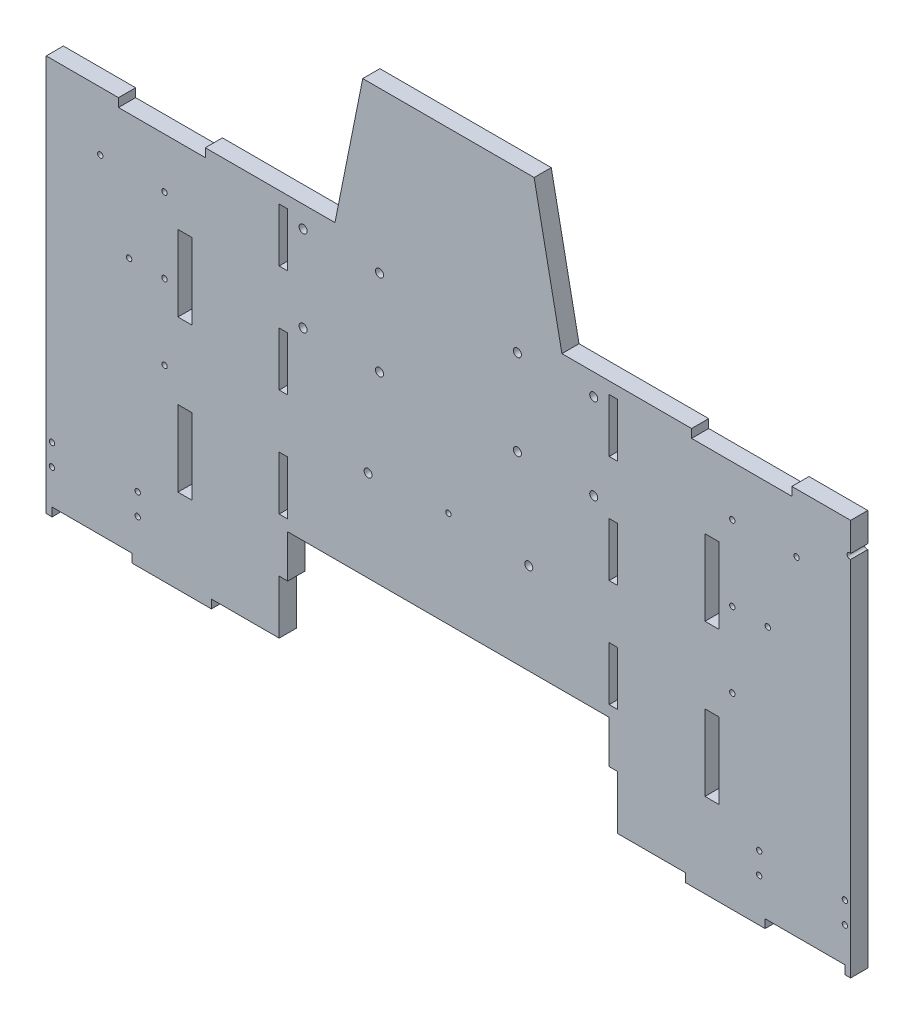
from build123d import *

# Parameters (mm, degrees)
BOSS_EXTRUDE1_DEPTH = 20.32
SKETCH2_W           = 120.284747719
SKETCH2_H           = 10.16
SKETCH2_W_2         = 118.872828106
SKETCH2_W_3         = 10.166490401
SKETCH2_H_2         = 89.916
SKETCH2_W_4         = 102.891608588
SKETCH2_W_5         = 94.453494602
SKETCH2_W_6         = 3.175
SKETCH2_W_7         = 561.9496
CUT_EXTRUDE1_DEPTH  = 137.414
SKETCH3_W           = 337.058
SKETCH3_H           = 124.46
CUT_EXTRUDE2_DEPTH  = 137.414
SKETCH4_W           = 10.16
SKETCH4_H           = 63.685061479
SKETCH4_H_2         = 63.685061478
CUT_EXTRUDE3_DEPTH  = 20.32
SKETCH10_R          = 3.175
CUT_EXTRUDE5_DEPTH  = 20.32
SKETCH12_R          = 4.7625
CUT_EXTRUDE6_DEPTH  = 917.604828076
SKETCH14_R          = 3.175
CUT_EXTRUDE7_DEPTH  = 917.604828076
SKETCH15_R          = 4.7625
SKETCH15_R_2        = 3.175
CUT_EXTRUDE8_DEPTH  = 917.604828076
SKETCH16_W          = 585.62283163
SKETCH16_H          = 602.215256286
SKETCH16_W_2        = 414.697903798
SKETCH16_H_2        = 659.676019196
CUT_EXTRUDE9_DEPTH  = 25.4


with BuildPart() as part:
    # Sketch1 → Boss-Extrude1 (new body)
    with BuildSketch(Plane.XY):
        Polygon((94.041322477, 150.485716341), (-175.036761108, 150.485716341), (-142.097719316, 314.8709952), (61.102280684, 314.8709952), align=None)
        with BuildLine():
            Line((-606.997271248, -319.414283659), (526.001832617, -319.414283659))
            add(Edge.make_bspline(
                [(583.362059287, -282.457957765), (581.029219579, -287.649310181), (577.879080401, -292.734699958), (570.038270446, -301.965622016), (565.348976837, -306.100497209), (554.949172694, -312.800933616), (549.248266441, -315.360306939), (537.611112797, -318.678742027), (531.685117348, -319.440968422), (526.001832617, -319.414283659)],
                knots=[0, 0, 0, 0, 0.25, 0.25, 0.5, 0.5, 0.75, 0.75, 1, 1, 1, 1], degree=3))
            Line((583.362059287, -282.457957765), (777.91409763, 150.485716341))
            Line((777.91409763, 150.485716341), (-858.909536262, 150.485716341))
            Line((-858.909536262, 150.485716341), (-664.600308277, -281.91762311))
            add(Edge.make_bspline(
                [(-664.600308277, -281.91762311), (-662.275037436, -287.157802838), (-659.126015856, -292.295113907), (-651.27178065, -301.630322109), (-646.567903812, -305.817478055), (-636.124076479, -312.615880857), (-630.393770919, -315.220849348), (-618.687590773, -318.618481158), (-612.722057732, -319.414283659), (-606.997271248, -319.414283659)],
                knots=[0, 0, 0, 0, 0.25, 0.25, 0.5, 0.5, 0.75, 0.75, 1, 1, 1, 1], degree=3))
        make_face()
    extrude(amount=BOSS_EXTRUDE1_DEPTH)

    # Sketch2 → Cut-Extrude1 (cut)
    with BuildSketch(Plane(origin=(0, 0, 0), x_dir=(-1, 0, 0), z_dir=(0, 0, -1))):
        with Locations((-547.078117621, 145.405716341)):
            Rectangle(SKETCH2_W, SKETCH2_H)
        with Locations((-307.214581989, 145.405716341)):
            Rectangle(SKETCH2_W_2, SKETCH2_H)
        with Locations((-271.919035422, 5.451716341)):
            Rectangle(SKETCH2_W_3, SKETCH2_H_2)
        with Locations((-271.919035422, -174.380283659)):
            Rectangle(SKETCH2_W_3, SKETCH2_H_2)
        with Locations((352.914474055, -174.380283659)):
            Rectangle(SKETCH2_W_3, SKETCH2_H_2)
        with Locations((352.914474055, 5.451716341)):
            Rectangle(SKETCH2_W_3, SKETCH2_H_2)
        with Locations((380.219410862, 145.405716341)):
            Rectangle(SKETCH2_W_4, SKETCH2_H)
        with Locations((586.002628038, 145.405716341)):
            Rectangle(SKETCH2_W_4, SKETCH2_H)
        with Locations((-382.157322587, -314.334283659)):
            Rectangle(SKETCH2_W_5, SKETCH2_H)
        with Locations((463.152761219, -314.334283659)):
            Rectangle(SKETCH2_W_5, SKETCH2_H)
        with Locations((-278.589780623, -174.380283659)):
            Rectangle(SKETCH2_W_6, SKETCH2_H_2)
        with Locations((-265.248290222, -174.380283659)):
            Rectangle(SKETCH2_W_6, SKETCH2_H_2)
        with Locations((-278.589780623, 5.451716341)):
            Rectangle(SKETCH2_W_6, SKETCH2_H_2)
        with Locations((-265.248290222, 5.451716341)):
            Rectangle(SKETCH2_W_6, SKETCH2_H_2)
        with Locations((346.243728854, 5.451716341)):
            Rectangle(SKETCH2_W_6, SKETCH2_H_2)
        with Locations((359.585219255, 5.451716341)):
            Rectangle(SKETCH2_W_6, SKETCH2_H_2)
        with Locations((346.243728854, -174.380283659)):
            Rectangle(SKETCH2_W_6, SKETCH2_H_2)
        with Locations((359.585219255, -174.380283659)):
            Rectangle(SKETCH2_W_6, SKETCH2_H_2)
        with Locations((40.497719316, -314.334283659)):
            Rectangle(SKETCH2_W_7, SKETCH2_H)
    extrude(amount=-CUT_EXTRUDE1_DEPTH, mode=Mode.SUBTRACT)

    # Sketch3 → Cut-Extrude2 (cut)
    with BuildSketch(Plane.XY.offset(20.32)):
        with Locations((-40.497719316, -257.184283659)):
            Rectangle(SKETCH3_W, SKETCH3_H)
    extrude(amount=-CUT_EXTRUDE2_DEPTH, mode=Mode.SUBTRACT)

    # Sketch4 → Cut-Extrude3 (cut)
    with BuildSketch(Plane(origin=(0, 0, 0), x_dir=(-1, 0, 0), z_dir=(0, 0, -1))):
        Polygon((-160.162280684, -245.551796758), (-160.162280684, -309.254283659), (-128.031280684, -309.254283659), (-128.031280684, -194.954283659), (-150.002280684, -194.954283659), (-150.002280684, -245.551796758), align=None)
        Polygon((241.157719316, -309.254283659), (241.157719316, -245.551796758), (230.997719316, -245.551796758), (230.997719316, -194.954283659), (209.026719316, -194.954283659), (209.026719316, -309.254283659), align=None)
        with Locations((-155.082280684, -150.02420454)):
            Rectangle(SKETCH4_W, SKETCH4_H)
        with Locations((-155.082280684, -22.654081584)):
            Rectangle(SKETCH4_W, SKETCH4_H)
        with Locations((-155.082280684, 104.698615951)):
            Rectangle(SKETCH4_W, SKETCH4_H_2)
        with Locations((236.077719316, -150.02420454)):
            Rectangle(SKETCH4_W, SKETCH4_H)
        with Locations((236.077719316, -22.654081584)):
            Rectangle(SKETCH4_W, SKETCH4_H)
        with Locations((236.077719316, 104.698615951)):
            Rectangle(SKETCH4_W, SKETCH4_H_2)
    extrude(amount=-CUT_EXTRUDE3_DEPTH, mode=Mode.SUBTRACT)

    # Sketch10 → Cut-Extrude5 (cut)
    with BuildSketch(Plane.XY):
        with Locations((372.252552874, 80.840970313)):
            Circle(SKETCH10_R)
        with Locations((296.052552874, 80.840970313)):
            Circle(SKETCH10_R)
        with Locations((296.052552874, -8.059029687)):
            Circle(SKETCH10_R)
        with Locations((338.076100273, -8.059019539)):
            Circle(SKETCH10_R)
        with Locations((296.052552874, -96.959029687)):
            Circle(SKETCH10_R)
        with Locations((327.929280684, -242.858683659)):
            Circle(SKETCH10_R)
        with Locations((327.929280684, -268.258683659)):
            Circle(SKETCH10_R)
        with Locations((429.529280684, -268.258683659)):
            Circle(SKETCH10_R)
        with Locations((429.529280684, -242.858683659)):
            Circle(SKETCH10_R)
        with Locations(Location((-510.524719316, -242.858683659, 0), (0, 0, 180))):
            Circle(SKETCH10_R)
        with Locations(Location((-510.524719316, -268.258683659, 0), (0, 0, 180))):
            Circle(SKETCH10_R)
        with Locations(Location((-408.924719316, -268.258683659, 0), (0, 0, 180))):
            Circle(SKETCH10_R)
        with Locations(Location((-408.924719316, -242.858683659, 0), (0, 0, 180))):
            Circle(SKETCH10_R)
        with Locations(Location((-377.047991505, -96.959029687, 0), (0, 0, 180))):
            Circle(SKETCH10_R)
        with Locations(Location((-419.071538905, -8.059019539, 0), (0, 0, 180))):
            Circle(SKETCH10_R)
        with Locations(Location((-377.047991505, -8.059029687, 0), (0, 0, 180))):
            Circle(SKETCH10_R)
        with Locations(Location((-377.047991505, 80.840970313, 0), (0, 0, 180))):
            Circle(SKETCH10_R)
        with Locations(Location((-453.247991505, 80.840970313, 0), (0, 0, 180))):
            Circle(SKETCH10_R)
    extrude(amount=CUT_EXTRUDE5_DEPTH, mode=Mode.SUBTRACT)

    # Sketch12 → Cut-Extrude6 (cut, through all)
    with BuildSketch(Plane(origin=(0, 0, 0), x_dir=(-1, 0, 0), z_dir=(0, 0, -1))):
        with Locations((-41.226780684, 125.085716341)):
            Circle(SKETCH12_R)
        with Locations((-41.226780684, 23.485716341)):
            Circle(SKETCH12_R)
        with Locations((-131.777780684, 23.485716341)):
            Circle(SKETCH12_R)
        with Locations((-131.777780684, 125.085716341)):
            Circle(SKETCH12_R)
        with Locations((212.773219316, 23.485716341)):
            Circle(SKETCH12_R)
        with Locations((212.773219316, 125.085716341)):
            Circle(SKETCH12_R)
        with Locations((122.222219316, 125.085716341)):
            Circle(SKETCH12_R)
        with Locations((122.222219316, 23.485716341)):
            Circle(SKETCH12_R)
    extrude(amount=-CUT_EXTRUDE6_DEPTH, mode=Mode.SUBTRACT)

    # Sketch14 → Cut-Extrude7 (cut, through all)
    with BuildSketch(Plane.XY.offset(20.32)):
        with Locations((435.255534848, 113.379343598)):
            Circle(SKETCH14_R)
        with Locations((485.903167936, 96.510716341)):
            Circle(SKETCH14_R)
        with Locations((485.903167936, 130.247970855)):
            Circle(SKETCH14_R)
    extrude(amount=-CUT_EXTRUDE7_DEPTH, mode=Mode.SUBTRACT)

    # Sketch15 → Cut-Extrude8 (cut, through all)
    with BuildSketch(Plane(origin=(0, 0, 0), x_dir=(-1, 0, 0), z_dir=(0, 0, -1))):
        with Locations((-54.752280684, -87.004283659)):
            Circle(SKETCH15_R)
        with Locations((135.747719316, -87.004283659)):
            Circle(SKETCH15_R)
        with Locations((40.497719316, -80.654283659)):
            Circle(SKETCH15_R_2)
    extrude(amount=-CUT_EXTRUDE8_DEPTH, mode=Mode.SUBTRACT)

    # Sketch16 → Cut-Extrude9 (cut)
    with BuildSketch(Plane(origin=(0, 0, 0), x_dir=(-1, 0, 0), z_dir=(0, 0, -1))):
        with Locations((810.161921947, -112.521911802)):
            Rectangle(SKETCH16_W, SKETCH16_H)
        with Locations((-643.704019399, -141.252293257)):
            Rectangle(SKETCH16_W_2, SKETCH16_H_2)
    extrude(amount=-CUT_EXTRUDE9_DEPTH, mode=Mode.SUBTRACT)


solid = part.part
